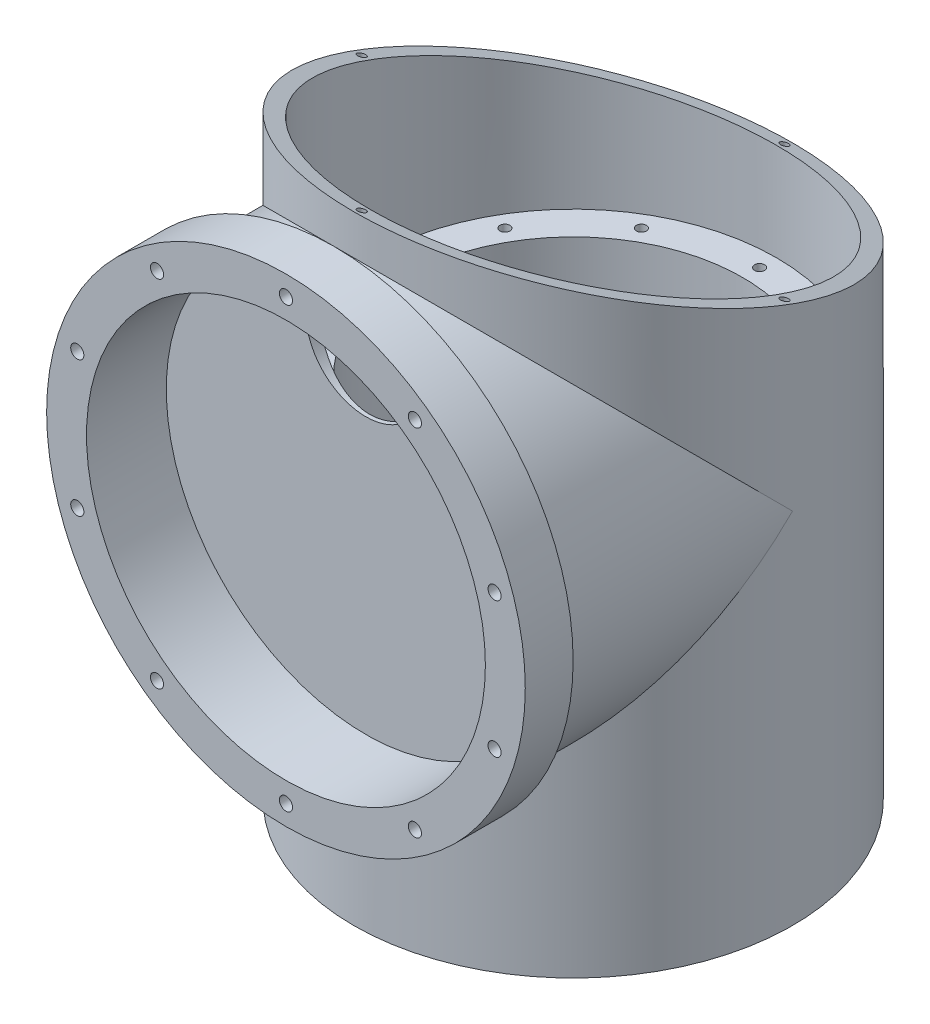
from build123d import *

# Parameters (mm, degrees)
SKETCH_1_R               = 55
EXTRUDE_4_DEPTH          = 60
EXTRUDE_5_DEPTH          = 65
EXTRUDE_5_DEPTH_BACK     = 90
SKETCH_7_R               = 55
SKETCH_8_R               = 35
CUT_EXTRUDE_1_DEPTH      = 176.071414
SKETCH_10_R              = 60
EXTRUDE_6_DEPTH          = 12
SKETCH_11_R              = 35
CUT_EXTRUDE_3_DEPTH      = 20
PATTERN_CIRCULAR_1_COUNT = 10
SKETCH_14_R              = 50
CUT_EXTRUDE_4_DEPTH      = 20
SKETCH_16_R              = 47.5
CUT_EXTRUDE_5_DEPTH      = 25
PATTERN_CIRCULAR_2_COUNT = 12
SKETCH_19_R              = 51
CUT_EXTRUDE_6_DEPTH      = 63
SKETCH_21_R              = 42.49
CUT_EXTRUDE_7_DEPTH      = 57
PATTERN_CIRCULAR_3_COUNT = 12
CUT_EXTRUDE_8_DEPTH      = 130.938446966
CUT_EXTRUDE_8_DEPTH_BACK = 130.938446966
SKETCH_25_R              = 1
CUT_EXTRUDE_9_DEPTH      = 26
SKETCH_26_R              = 1
CUT_EXTRUDE_10_DEPTH     = 46
SKETCH_27_R              = 1
CUT_EXTRUDE_11_DEPTH     = 7
SKETCH_28_R              = 15
CUT_EXTRUDE_13_DEPTH     = 20


with BuildPart() as part:
    # 草图1 → 凸台-拉伸4 (new body)
    with BuildSketch(Plane.XY):
        Circle(SKETCH_1_R)
    extrude(amount=EXTRUDE_4_DEPTH)

    # 草图7 → 凸台-拉伸5 (add, two sides: drawn at the far end of the back side and taken through both)
    with BuildSketch(Plane(origin=(0, 0, 0), x_dir=(1, 0, 0), z_dir=(0, 1, 0)).offset(-EXTRUDE_5_DEPTH_BACK)):
        with Locations(Location((0, 0, 0), (0, 0, 270))):
            Circle(SKETCH_7_R)
    extrude(amount=EXTRUDE_5_DEPTH + EXTRUDE_5_DEPTH_BACK)

    # 草图8 → 切除-拉伸1 (cut, through all)
    with BuildSketch(Plane(origin=(0, 65, 0), x_dir=(1, 0, 0), z_dir=(0, 1, 0))):
        with Locations(Location((0, 0, 0), (0, 0, 270))):
            Circle(SKETCH_8_R)
    extrude(amount=-CUT_EXTRUDE_1_DEPTH, mode=Mode.SUBTRACT)

    # 草图10 → 凸台-拉伸6 (add)
    with BuildSketch(Plane.XY.offset(60)):
        Circle(SKETCH_10_R)
    extrude(amount=EXTRUDE_6_DEPTH)

    # 草图11 → 切除-拉伸3 (cut)
    with BuildSketch(Plane.XY.offset(72)):
        Circle(SKETCH_11_R)
    extrude(amount=-CUT_EXTRUDE_3_DEPTH, mode=Mode.SUBTRACT)

    # 草图12 → M4 螺纹孔1 (revolve, cut)
    with BuildSketch(Plane(origin=(0, 55, 72), x_dir=(0, -1, 0), z_dir=(1, 0, 0))):
        Polygon((0, 0), (0, 11.091420021), (1.65, 10.1), (1.65, 0), align=None)
    hole_wizard_m4_1 = revolve(axis=Axis((0, 55, 78.35), (0, 0, -1)), mode=Mode.SUBTRACT)

    # 阵列(圆周)1: M4 螺纹孔1 ×10 about axis
    pattern_circular_1_axis = Axis((0, 0, 0), (0, 0, 1))
    for i in range(1, PATTERN_CIRCULAR_1_COUNT):
        add(hole_wizard_m4_1.rotate(pattern_circular_1_axis, i * 360 / PATTERN_CIRCULAR_1_COUNT), mode=Mode.SUBTRACT)

    # 草图14 → 切除-拉伸4 (cut)
    with BuildSketch(Plane.XY.offset(72)):
        Circle(SKETCH_14_R)
    extrude(amount=-CUT_EXTRUDE_4_DEPTH, mode=Mode.SUBTRACT)

    # 草图16 → 切除-拉伸5 (cut)
    with BuildSketch(Plane.XZ.offset(90)):
        with Locations(Location((0, 0, 0), (0, 0, 270))):
            Circle(SKETCH_16_R)
    extrude(amount=-CUT_EXTRUDE_5_DEPTH, mode=Mode.SUBTRACT)

    # 草图17 → M3 螺纹孔1 (revolve, cut)
    with BuildSketch(Plane(origin=(0, -65, 42), x_dir=(0, 0, -1), z_dir=(1, 0, 0))):
        Polygon((0, 0), (0, 8.251075774), (1.25, 7.5), (1.25, 0), align=None)
    hole_wizard_m3_1 = revolve(axis=Axis((0, -71.35, 42), (0, 1, 0)), mode=Mode.SUBTRACT)

    # 阵列(圆周)2: M3 螺纹孔1 ×12 about axis
    pattern_circular_2_axis = Axis((0, 0, 0), (0, 1, 0))
    for i in range(1, PATTERN_CIRCULAR_2_COUNT):
        add(hole_wizard_m3_1.rotate(pattern_circular_2_axis, i * 360 / PATTERN_CIRCULAR_2_COUNT), mode=Mode.SUBTRACT)

    # 草图19 → 切除-拉伸6 (cut)
    with BuildSketch(Plane(origin=(0, 65, 0), x_dir=(1, 0, 0), z_dir=(0, 1, 0))):
        with Locations(Location((0, 0, 0), (0, 0, 270))):
            Circle(SKETCH_19_R)
    extrude(amount=-CUT_EXTRUDE_6_DEPTH, mode=Mode.SUBTRACT)

    # 草图21 → 切除-拉伸7 (cut)
    with BuildSketch(Plane(origin=(0, 2, 0), x_dir=(1, 0, 0), z_dir=(0, 1, 0))):
        with Locations(Location((0, 0, 0), (0, 0, 270))):
            Circle(SKETCH_21_R)
    extrude(amount=-CUT_EXTRUDE_7_DEPTH, mode=Mode.SUBTRACT)

    # 草图22 → M3 螺纹孔2 (revolve, cut)
    with BuildSketch(Plane(origin=(0, 2, -46.75), x_dir=(0, 0, 1), z_dir=(1, 0, 0))):
        Polygon((0, 0), (0, 8.251075774), (1.25, 7.5), (1.25, 0), align=None)
    hole_wizard_m3_2 = revolve(axis=Axis((0, 8.35, -46.75), (0, -1, 0)), mode=Mode.SUBTRACT)

    # 阵列(圆周)3: M3 螺纹孔2 ×12 about axis
    pattern_circular_3_axis = Axis((0, 0, 0), (0, 1, 0))
    for i in range(1, PATTERN_CIRCULAR_3_COUNT):
        add(hole_wizard_m3_2.rotate(pattern_circular_3_axis, i * 360 / PATTERN_CIRCULAR_3_COUNT), mode=Mode.SUBTRACT)

    # 草图24 → 切除-拉伸8 (cut, two sides: drawn at the far end of the back side and taken through both)
    with BuildSketch(Plane(origin=(0, 0, 0), x_dir=(0, 0, -1), z_dir=(1, 0, 0)).offset(-CUT_EXTRUDE_8_DEPTH_BACK)):
        Polygon((-55, 65), (55, 65), (55, 24.963274231), align=None)
    extrude(amount=CUT_EXTRUDE_8_DEPTH + CUT_EXTRUDE_8_DEPTH_BACK, mode=Mode.SUBTRACT)

    # 草图25 → 切除-拉伸9 (cut)
    with BuildSketch(Plane(origin=(0, 65, 0), x_dir=(1, 0, 0), z_dir=(0, 1, 0))):
        with Locations(Location((53, 0, 0), (0, 0, 270))):
            Circle(SKETCH_25_R)
        with Locations(Location((-53, 0, 0), (0, 0, 270))):
            Circle(SKETCH_25_R)
    extrude(amount=-CUT_EXTRUDE_9_DEPTH, mode=Mode.SUBTRACT)

    # 草图26 → 切除-拉伸10 (cut)
    with BuildSketch(Plane(origin=(0, 65, 0), x_dir=(1, 0, 0), z_dir=(0, 1, 0))):
        with Locations(Location((0, 53, 0), (0, 0, 270))):
            Circle(SKETCH_26_R)
    extrude(amount=-CUT_EXTRUDE_10_DEPTH, mode=Mode.SUBTRACT)

    # 草图27 → 切除-拉伸11 (cut)
    with BuildSketch(Plane(origin=(0, 65, 0), x_dir=(1, 0, 0), z_dir=(0, 1, 0))):
        with Locations(Location((0, -53, 0), (0, 0, 270))):
            Circle(SKETCH_27_R)
    extrude(amount=-CUT_EXTRUDE_11_DEPTH, mode=Mode.SUBTRACT)

    # 草图28 → 切除-拉伸13 (cut)
    with BuildSketch(Plane.XY.offset(52)):
        with Locations((0, 34)):
            Circle(SKETCH_28_R)
    extrude(amount=-CUT_EXTRUDE_13_DEPTH, mode=Mode.SUBTRACT)


solid = part.part
